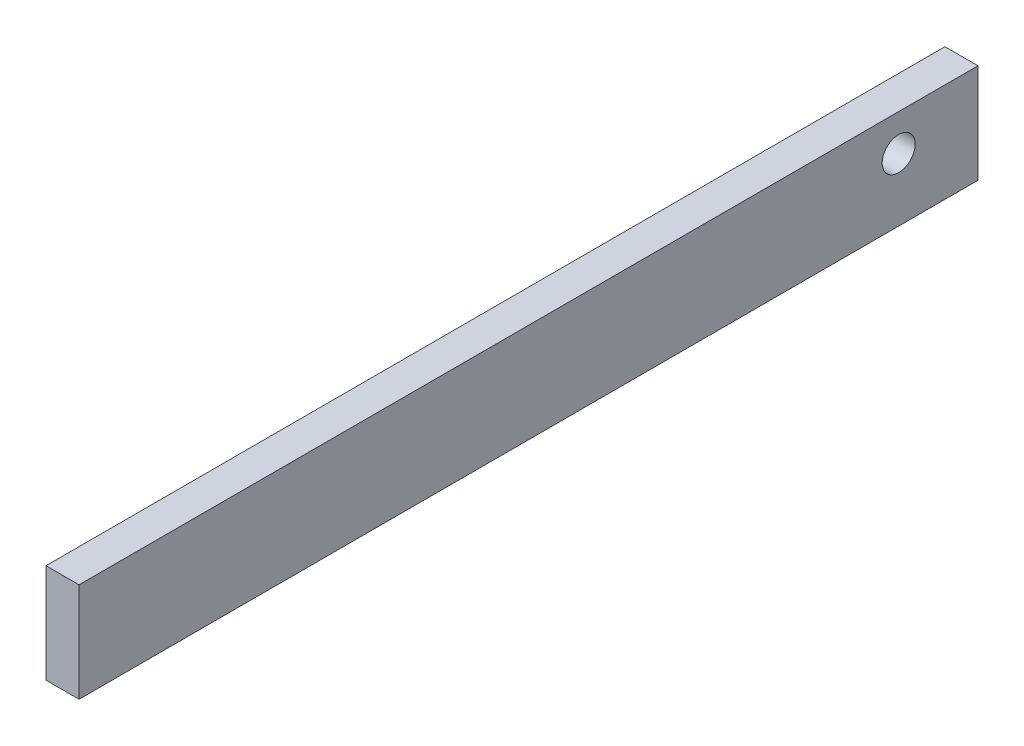
from build123d import *

# Parameters (mm, degrees)
SKETCH1_W           = 6.35
SKETCH1_H           = 19.05
BOSS_EXTRUDE1_DEPTH = 172.72
SKETCH4_R           = 3.175000102
CUT_EXTRUDE3_DEPTH  = 25.4


with BuildPart() as part:
    # Sketch1 → Boss-Extrude1 (new body)
    with BuildSketch(Plane.XY):
        with Locations((-3.175, 9.525)):
            Rectangle(SKETCH1_W, SKETCH1_H)
    extrude(amount=BOSS_EXTRUDE1_DEPTH)

    # Sketch4 → Cut-Extrude3 (cut)
    with BuildSketch(Plane(origin=(0, 0, 0), x_dir=(0, 0, -1), z_dir=(1, 0, 0))):
        with Locations((-15.24, 12.065)):
            Circle(SKETCH4_R)
    extrude(amount=-CUT_EXTRUDE3_DEPTH, mode=Mode.SUBTRACT)


solid = part.part
